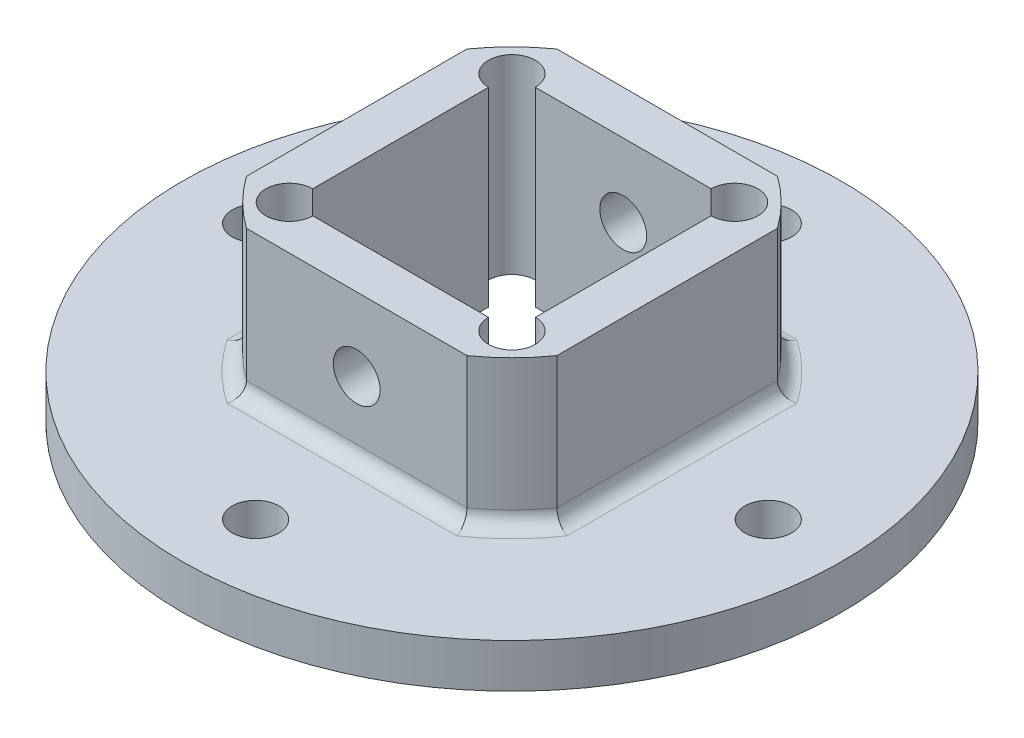
from build123d import *

# Parameters (mm, degrees)
SKETCH_1_R          = 22.5
SKETCH_1_R_2        = 1.6
SKETCH_1_W          = 15.2
SKETCH_1_H          = 15.2
EXTRUDE_1_DEPTH     = 3
SKETCH_2_W          = 15.2
SKETCH_2_H          = 15.2
EXTRUDE_2_DEPTH     = 10
SKETCH_3_R          = 1.6
CUT_EXTRUDE_1_DEPTH = 43.081587423
FILLET_1_R          = 1
SKETCH_4_R          = 1.6
CUT_EXTRUDE_2_DEPTH = 35.372954485


with BuildPart() as part:
    # 草图1 → 凸台-拉伸1 (new body)
    with BuildSketch(Plane(origin=(0, 0, 0), x_dir=(1, 0, 0), z_dir=(0, 1, 0))):
        with Locations(Location((0, 0, 0), (0, 0, 270))):
            Circle(SKETCH_1_R)
        with Locations(Location((0, 17.5, 0), (0, 0, 270))):
            Circle(SKETCH_1_R_2, mode=Mode.SUBTRACT)
        with Locations(Location((17.5, 0, 0), (0, 0, 270))):
            Circle(SKETCH_1_R_2, mode=Mode.SUBTRACT)
        with Locations(Location((0, -17.5, 0), (0, 0, 270))):
            Circle(SKETCH_1_R_2, mode=Mode.SUBTRACT)
        with Locations(Location((-17.5, 0, 0), (0, 0, 270))):
            Circle(SKETCH_1_R_2, mode=Mode.SUBTRACT)
        Rectangle(SKETCH_1_W, SKETCH_1_H, mode=Mode.SUBTRACT)
    extrude(amount=EXTRUDE_1_DEPTH)

    # 草图2 → 凸台-拉伸2 (add)
    with BuildSketch(Plane(origin=(0, 3, 0), x_dir=(1, 0, 0), z_dir=(0, 1, 0))):
        with BuildLine():
            Line((-10.6, -7.525955089), (-10.6, 7.525955089))
            ThreePointArc((-10.6, 7.525955089), (-9.192388155, 9.192388155), (-7.525955089, 10.6))
            Line((-7.525955089, 10.6), (7.525955089, 10.6))
            ThreePointArc((7.525955089, 10.6), (9.192388155, 9.192388155), (10.6, 7.525955089))
            Line((10.6, 7.525955089), (10.6, -7.525955089))
            ThreePointArc((10.6, -7.525955089), (9.192388155, -9.192388155), (7.525955089, -10.6))
            Line((7.525955089, -10.6), (-7.525955089, -10.6))
            ThreePointArc((-7.525955089, -10.6), (-9.192388155, -9.192388155), (-10.6, -7.525955089))
        make_face()
        Rectangle(SKETCH_2_W, SKETCH_2_H, mode=Mode.SUBTRACT)
    extrude(amount=EXTRUDE_2_DEPTH)

    # 草图3 → 切除-拉伸1 (cut, through all)
    with BuildSketch(Plane(origin=(0, 0, -10.6), x_dir=(-1, 0, 0), z_dir=(0, 0, -1))):
        with Locations((0, 8)):
            Circle(SKETCH_3_R)
    extrude(amount=-CUT_EXTRUDE_1_DEPTH, mode=Mode.SUBTRACT)

    # 圆角1
    fillet_1_edges = [part.edges().sort_by_distance(p)[0] for p in [
        (9.192388155, 3, 9.192388155),
        (10.6, 3, 0),
        (9.192388155, 3, -9.192388155),
        (0, 3, -10.6),
        (-9.192388155, 3, -9.192388155),
        (-10.6, 3, 0),
        (-9.192388155, 3, 9.192388155),
        (0, 3, 10.6),
    ]]
    fillet(fillet_1_edges, radius=FILLET_1_R)

    # 草图4 → 切除-拉伸2 (cut, through all)
    with BuildSketch(Plane(origin=(0, 13, 0), x_dir=(1, 0, 0), z_dir=(0, 1, 0))):
        with Locations((7.6, 7.6)):
            Circle(SKETCH_4_R)
        with Locations((7.6, -7.6)):
            Circle(SKETCH_4_R)
        with Locations((-7.6, -7.6)):
            Circle(SKETCH_4_R)
        with Locations((-7.6, 7.6)):
            Circle(SKETCH_4_R)
    extrude(amount=-CUT_EXTRUDE_2_DEPTH, mode=Mode.SUBTRACT)


solid = part.part
